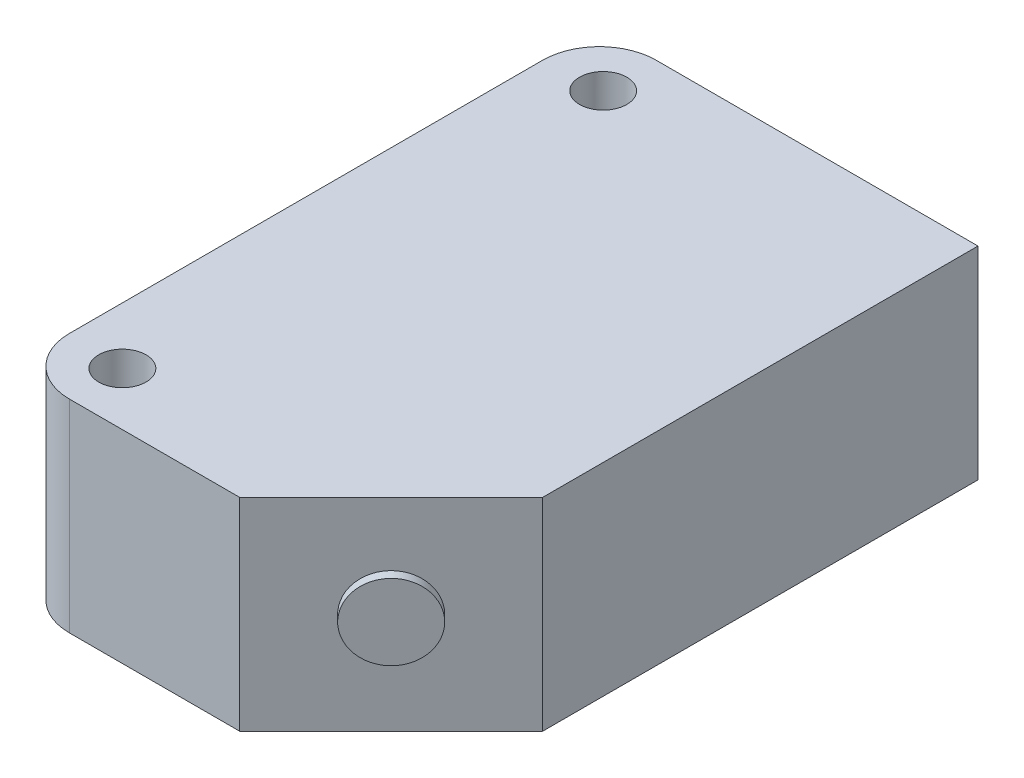
from build123d import *

# Parameters (mm, degrees)
SKETCH_1_W          = 20
SKETCH_1_H          = 31
EXTRUDE_1_DEPTH     = 10.7
SKETCH_2_R          = 1.25
CUT_EXTRUDE_1_DEPTH = 40.7
CHAMFER_1_SIZE      = 8
SKETCH_3_R          = 2
EXTRUDE_2_DEPTH     = 0.5
FILLET_1_R          = 3


with BuildPart() as part:
    # 草图1 → 凸台-拉伸1 (new body)
    with BuildSketch(Plane(origin=(0, 0, 0), x_dir=(1, 0, 0), z_dir=(0, 1, 0))):
        Rectangle(SKETCH_1_W, SKETCH_1_H)
    extrude(amount=EXTRUDE_1_DEPTH)

    # 草图2 → 切除-拉伸1 (cut)
    with BuildSketch(Plane(origin=(0, 10.7, 0), x_dir=(1, 0, 0), z_dir=(0, 1, 0))):
        with Locations(Location((-7, 12.7, 0), (0, 0, 270))):
            Circle(SKETCH_2_R)
        with Locations(Location((-7, -12.7, 0), (0, 0, 90))):
            Circle(SKETCH_2_R)
    extrude(amount=-CUT_EXTRUDE_1_DEPTH, mode=Mode.SUBTRACT)

    # 倒角1
    chamfer_1_edges = [part.edges().sort_by_distance(p)[0] for p in [
        (10, 5.35, 15.5),
    ]]
    chamfer(chamfer_1_edges, length=CHAMFER_1_SIZE)

    # 草图3 → 凸台-拉伸2 (add)
    with BuildSketch(Plane(origin=(8.75, 0, 8.75), x_dir=(0.7071067811865485, 0, -0.7071067811865466), z_dir=(0.7071067811865466, 0, 0.7071067811865485))):
        with Locations((-3.889087297, 5.35)):
            Circle(SKETCH_3_R)
    extrude(amount=EXTRUDE_2_DEPTH)

    # 圆角1
    fillet_1_edges = [part.edges().sort_by_distance(p)[0] for p in [
        (-10, 5.35, -15.5),
        (-10, 5.35, 15.5),
    ]]
    fillet(fillet_1_edges, radius=FILLET_1_R)


solid = part.part
